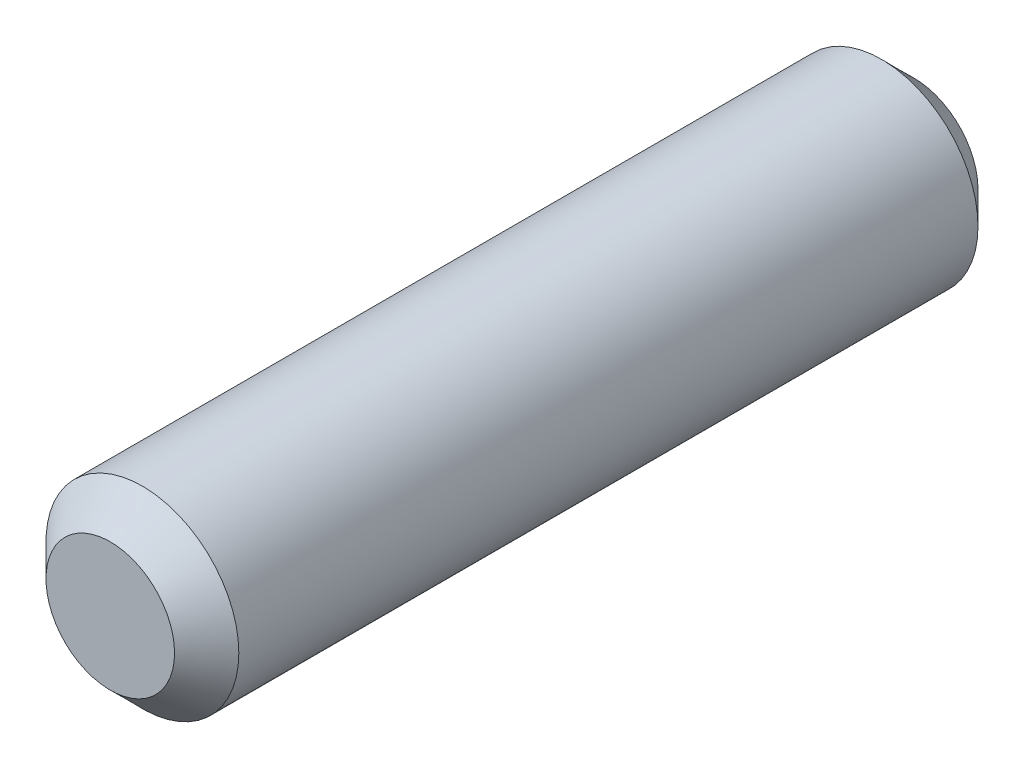
from build123d import *

# Parameters (mm, degrees)
SKETCH_1_R      = 3
EXTRUDE_1_DEPTH = 25
CHAMFER_1_SIZE  = 1


with BuildPart() as part:
    # 草图1 → 拉伸1 (new body)
    with BuildSketch(Plane.XY):
        Circle(SKETCH_1_R)
    extrude(amount=EXTRUDE_1_DEPTH)

    # 倒角1
    chamfer_1_edges = [part.edges().sort_by_distance(p)[0] for p in [
        (-3, 0, 0),
        (-3, 0, 25),
    ]]
    chamfer(chamfer_1_edges, length=CHAMFER_1_SIZE)


solid = part.part
